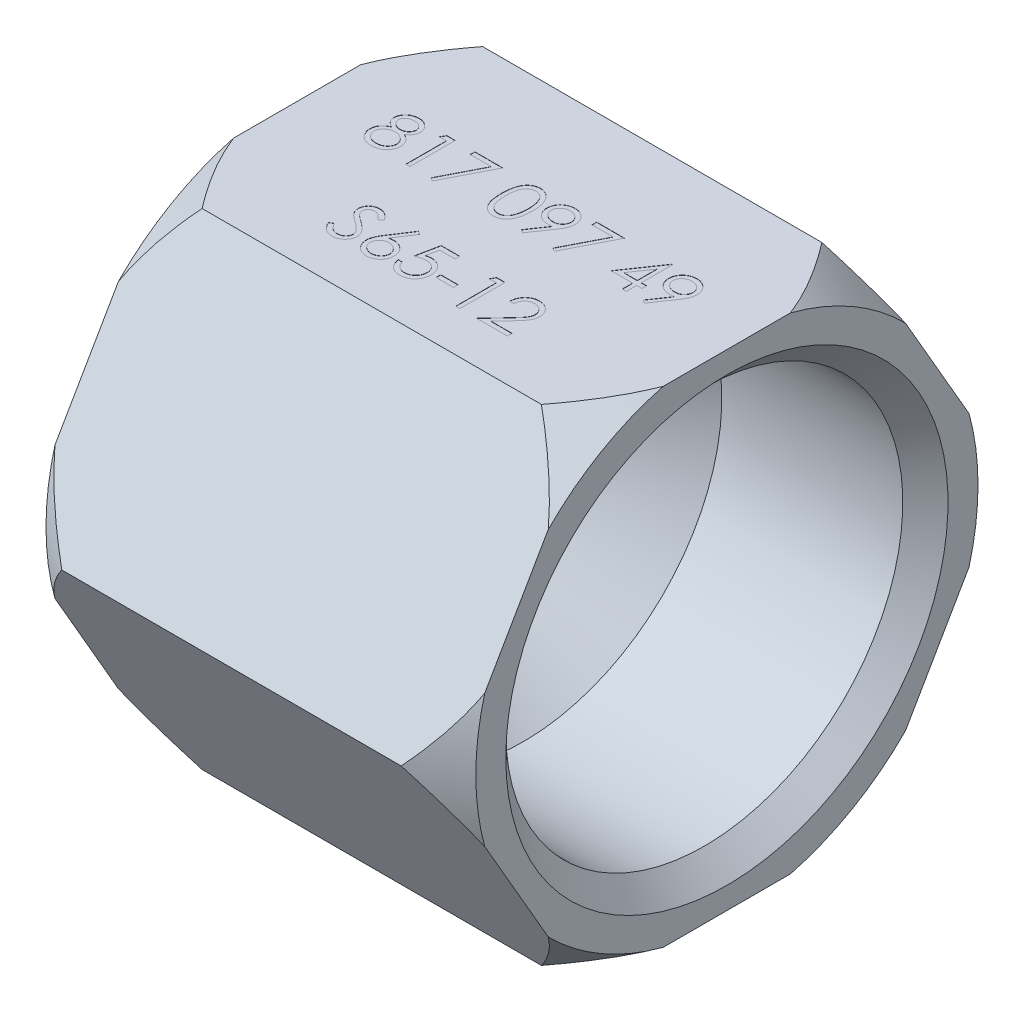
from build123d import *

# Parameters (mm, degrees)
SKETCH2_OUTSIDE_W  = 34.778
SKETCH2_OUTSIDE_H  = 34.778
EXTRUDE1_DEPTH     = 19
CHAMFER1_SIZE      = 1
SKETCH3_W          = 0.769230769
SKETCH3_H          = 0.205128205
CUT_EXTRUDE1_DEPTH = 0.01


with BuildPart() as part:
    # Sketch1 → Revolve1 (revolve)
    with BuildSketch(Plane.XY, mode=Mode.PRIVATE) as revolve1_sk:
        Polygon((0, 0), (0, 11.1), (2, 12.4), (17, 12.4), (19, 11.1), (19, 8.775), (10, 8.775), (5, 5), (1.995696905, 0), align=None)
    revolve(revolve1_sk.sketch.rotate(Axis((0, 0, 0), (1, 0, 0)), 90), axis=Axis((0, 0, 0), (1, 0, 0)))

    # Sketch2 outside → Extrude1 (cut)
    with BuildSketch(Plane(origin=(19, 0, 0), x_dir=(0, 0, -1), z_dir=(1, 0, 0))):
        Rectangle(SKETCH2_OUTSIDE_W, SKETCH2_OUTSIDE_H)
        Polygon((6.2, 10.738715007), (-6.2, 10.738715007), (-12.4, 0), (-6.2, -10.738715007), (6.2, -10.738715007), (12.4, 0), align=None, mode=Mode.SUBTRACT)
    extrude(amount=-EXTRUDE1_DEPTH, mode=Mode.SUBTRACT)

    # Chamfer1
    chamfer1_edges = [part.edges().sort_by_distance(p)[0] for p in [
        (19, 0, -8.775),
    ]]
    chamfer(chamfer1_edges, length=CHAMFER1_SIZE)

    # Sketch3 → Cut-Extrude1 (cut)
    # profile 1 of 14: a face of its own
    with BuildSketch(Plane(origin=(0, 10.738715007, 0), x_dir=(1, 0, 0), z_dir=(0, 1, 0))):
        with BuildLine():
            add(Edge.make_bspline(
                [(3.626201923, 1.114182692), (3.642572521, 1.105646717), (3.674500656, 1.088998716), (3.719973346, 1.062192529), (3.761530489, 1.033940549), (3.800325096, 1.0055772), (3.835675582, 0.976016257), (3.867186675, 0.945140167), (3.895636744, 0.913719627), (3.920452049, 0.881222576), (3.942278813, 0.847735348), (3.96114289, 0.813170049), (3.977267006, 0.77760243), (3.990045828, 0.740644241), (4.000572566, 0.702838377), (4.007815769, 0.663696673), (4.011711151, 0.62347705), (4.012447616, 0.596295163), (4.012820513, 0.582532051)],
                knots=[0, 0, 0, 0, 1.272397273, 2.481599622, 3.635517121, 4.734568067, 5.792894095, 6.808321871, 7.773003508, 8.711915296, 9.623354172, 10.525449501, 11.423591555, 12.311487226, 13.218079475, 14.126165749, 15.051214107, 16, 16, 16, 16], degree=3))
            add(Edge.make_bspline(
                [(4.012820513, 0.582532051), (4.012379701, 0.563276204), (4.011507169, 0.525161657), (4.003907178, 0.468906736), (3.992528334, 0.414271433), (3.975911469, 0.361267723), (3.95436096, 0.310188082), (3.927802768, 0.260988782), (3.897739223, 0.212863463), (3.873595086, 0.183252376), (3.861378205, 0.168269231)],
                knots=[0, 0, 0, 0, 1.025265484, 2.029385089, 3.018602448, 3.995076438, 4.983346944, 5.966715145, 6.97116228, 8, 8, 8, 8], degree=3))
            add(Edge.make_bspline(
                [(3.861378205, 0.168269231), (3.845471648, 0.150787074), (3.813855097, 0.116038793), (3.759693424, 0.070924044), (3.700252347, 0.033010105), (3.635761871, 0.002111879), (3.566394385, -0.021937183), (3.492164668, -0.039218622), (3.412928009, -0.049117153), (3.35846774, -0.050548004), (3.330528846, -0.051282051)],
                knots=[0, 0, 0, 0, 0.954267603, 1.896743057, 2.838368354, 3.796610408, 4.779680527, 5.799409237, 6.871065594, 8, 8, 8, 8], degree=3))
            add(Edge.make_bspline(
                [(3.330528846, -0.051282051), (3.303664053, -0.050623492), (3.251387893, -0.049342004), (3.175297678, -0.040659472), (3.104370209, -0.025443548), (3.038193084, -0.004618057), (2.97716526, 0.022473502), (2.92146063, 0.056192593), (2.870275503, 0.095181989), (2.825163233, 0.140561462), (2.785112693, 0.18916596), (2.749930949, 0.239309737), (2.720688618, 0.29099737), (2.695930278, 0.343458151), (2.676977122, 0.397427382), (2.663850145, 0.45262739), (2.655513394, 0.508961757), (2.654404174, 0.546979845), (2.653846154, 0.566105769)],
                knots=[0, 0, 0, 0, 1.256902934, 2.445805442, 3.576955095, 4.645999104, 5.686449165, 6.692658513, 7.68621702, 8.689161843, 9.678783111, 10.630372946, 11.551080876, 12.453998257, 13.34127905, 14.221779781, 15.105423033, 16, 16, 16, 16], degree=3))
            add(Edge.make_bspline(
                [(2.653846154, 0.566105769), (2.654176372, 0.580139593), (2.654828998, 0.607875383), (2.659346054, 0.648852142), (2.666608032, 0.688735648), (2.676470579, 0.727673215), (2.68983688, 0.765381371), (2.705975242, 0.802038785), (2.7247935, 0.837686841), (2.746554166, 0.872520487), (2.771869608, 0.906051637), (2.800534551, 0.938849348), (2.833121905, 0.970404701), (2.869269138, 1.00110323), (2.908563161, 1.0314895), (2.952024607, 1.059921345), (2.998501331, 1.088411611), (3.031532992, 1.10544494), (3.048477564, 1.114182692)],
                knots=[0, 0, 0, 0, 0.941657376, 1.861047343, 2.762797495, 3.66048619, 4.553285746, 5.444104102, 6.34607688, 7.256116206, 8.197091036, 9.162375105, 10.176350973, 11.237807142, 12.343728897, 13.50695164, 14.721116704, 16, 16, 16, 16], degree=3))
            add(Edge.make_bspline(
                [(3.048477564, 1.114182692), (3.025282493, 1.126831132), (2.980370343, 1.15132205), (2.920902091, 1.196320225), (2.869821734, 1.245056119), (2.828533324, 1.298558859), (2.796034908, 1.355157073), (2.773738563, 1.414496646), (2.758654858, 1.475477282), (2.757160671, 1.517137966), (2.756410256, 1.538060897)],
                knots=[0, 0, 0, 0, 1.166880483, 2.259407225, 3.286803203, 4.280235371, 5.237608625, 6.161067461, 7.076446754, 8, 8, 8, 8], degree=3))
            add(Edge.make_bspline(
                [(2.756410256, 1.538060897), (2.757344784, 1.559373788), (2.759223349, 1.602216415), (2.774413818, 1.665991342), (2.799168141, 1.72862938), (2.832837283, 1.78982693), (2.874772835, 1.847512767), (2.925085147, 1.89925045), (2.982572745, 1.944571297), (3.046948669, 1.982614825), (3.116226518, 2.013576915), (3.189321217, 2.034936014), (3.264959213, 2.048899509), (3.316443624, 2.050480455), (3.342548077, 2.051282051)],
                knots=[0, 0, 0, 0, 0.888701115, 1.786444228, 2.72001202, 3.692817113, 4.693886446, 5.687152267, 6.695133018, 7.739871481, 8.800368666, 9.853104506, 10.91144658, 12, 12, 12, 12], degree=3))
            add(Edge.make_bspline(
                [(3.342548077, 2.051282051), (3.367978828, 2.05045557), (3.418125373, 2.048825842), (3.491836589, 2.03523334), (3.56236509, 2.012530757), (3.629467661, 1.981732344), (3.691943014, 1.943796949), (3.747144333, 1.897853592), (3.795905809, 1.846344135), (3.836239748, 1.78867579), (3.869475685, 1.727713394), (3.892619057, 1.663929096), (3.907448757, 1.598701062), (3.90931925, 1.55456506), (3.91025641, 1.532451923)],
                knots=[0, 0, 0, 0, 1.072916533, 2.115669174, 3.151510826, 4.193348718, 5.225979165, 6.227137561, 7.216255879, 8.211077061, 9.189680878, 10.138522389, 11.067357538, 12, 12, 12, 12], degree=3))
            add(Edge.make_bspline(
                [(3.91025641, 1.532451923), (3.909436661, 1.510750972), (3.907826721, 1.468131538), (3.894283898, 1.406002098), (3.871476291, 1.347818076), (3.840336769, 1.292919246), (3.799750776, 1.242301247), (3.750260072, 1.195320407), (3.692259227, 1.151590791), (3.648681578, 1.126912869), (3.626201923, 1.114182692)],
                knots=[0, 0, 0, 0, 0.975232327, 1.915300861, 2.843280834, 3.77672583, 4.742871857, 5.749627742, 6.839139064, 8, 8, 8, 8], degree=3))
        make_face()
        with BuildLine():
            add(Edge.make_bspline(
                [(3.332532051, 1.846153846), (3.318503019, 1.845781594), (3.291056099, 1.845053307), (3.250811144, 1.841248372), (3.21254122, 1.833846534), (3.175846476, 1.823995841), (3.141230012, 1.81068842), (3.108221695, 1.795034129), (3.077383301, 1.776002091), (3.048342557, 1.754652835), (3.022199257, 1.731171175), (2.998996656, 1.706706192), (2.979723448, 1.680777397), (2.9633571, 1.654029763), (2.951481947, 1.625669433), (2.942588059, 1.596565904), (2.936575835, 1.566351399), (2.936125326, 1.545701964), (2.935897436, 1.53525641)],
                knots=[0, 0, 0, 0, 1.203892937, 2.355340988, 3.463153438, 4.544400666, 5.610487187, 6.640501085, 7.674077295, 8.714426146, 9.728707835, 10.68524104, 11.601827946, 12.495867327, 13.368432065, 14.231010473, 15.105153427, 16, 16, 16, 16], degree=3))
            add(Edge.make_bspline(
                [(2.935897436, 1.53525641), (2.936290217, 1.524810405), (2.937066409, 1.504167597), (2.943069339, 1.473684245), (2.952016113, 1.443729024), (2.966102206, 1.415014218), (2.982997267, 1.386543727), (3.00384954, 1.359029107), (3.028700413, 1.332374601), (3.056716093, 1.30680692), (3.087236972, 1.28286477), (3.11957071, 1.262080095), (3.153311506, 1.244689174), (3.188112688, 1.230215229), (3.224328944, 1.218963836), (3.261738357, 1.210981752), (3.300347216, 1.206020611), (3.326507547, 1.205428028), (3.33974359, 1.205128205)],
                knots=[0, 0, 0, 0, 0.873023192, 1.725219244, 2.590779336, 3.480155217, 4.391973325, 5.357036234, 6.360879153, 7.436073238, 8.526419356, 9.601555421, 10.645666583, 11.697338044, 12.750135903, 13.812665442, 14.89329948, 16, 16, 16, 16], degree=3))
            add(Edge.make_bspline(
                [(3.33974359, 1.205128205), (3.356743649, 1.205626986), (3.390575859, 1.206619622), (3.440449763, 1.215848865), (3.488942703, 1.230366532), (3.535536362, 1.25022937), (3.579024697, 1.275159575), (3.61779045, 1.305007014), (3.65150296, 1.339082498), (3.67981188, 1.376855547), (3.701760364, 1.417056455), (3.718847111, 1.457399479), (3.728824949, 1.49831504), (3.730126415, 1.525724734), (3.730769231, 1.539262821)],
                knots=[0, 0, 0, 0, 1.076279235, 2.141928126, 3.20205304, 4.278698113, 5.344010996, 6.36967002, 7.368914609, 8.37248503, 9.349703398, 10.264243087, 11.142681841, 12, 12, 12, 12], degree=3))
            add(Edge.make_bspline(
                [(3.730769231, 1.539262821), (3.730465289, 1.548764555), (3.729862009, 1.567624137), (3.724890548, 1.595474631), (3.716675787, 1.622691536), (3.705554027, 1.649499691), (3.690919858, 1.675522967), (3.673568894, 1.701170445), (3.652492036, 1.725865168), (3.628836931, 1.750182624), (3.602010983, 1.77268778), (3.572065891, 1.792479043), (3.539155176, 1.809286104), (3.503278062, 1.822936821), (3.464566677, 1.833189592), (3.42319932, 1.840867505), (3.378831065, 1.845194998), (3.348299778, 1.845827298), (3.332532051, 1.846153846)],
                knots=[0, 0, 0, 0, 0.814439003, 1.616544685, 2.417341072, 3.248991801, 4.09997495, 4.973547432, 5.9003056, 6.880240646, 7.880314356, 8.896779544, 9.951930927, 11.043077905, 12.18215768, 13.381699519, 14.647792085, 16, 16, 16, 16], degree=3))
        make_face(mode=Mode.SUBTRACT)
        with BuildLine():
            add(Edge.make_bspline(
                [(3.344150641, 1), (3.326364478, 0.999683634), (3.291472366, 0.999063), (3.240354121, 0.992154714), (3.191295169, 0.982537918), (3.14446092, 0.967948867), (3.09987115, 0.948979444), (3.057284474, 0.926159707), (3.017026686, 0.899185168), (2.9796537, 0.868398531), (2.945526083, 0.8352217), (2.915584197, 0.80010048), (2.890157043, 0.763687604), (2.869680899, 0.725520616), (2.852874195, 0.686407695), (2.841837694, 0.645374784), (2.83476243, 0.603210719), (2.833812355, 0.574547805), (2.833333333, 0.560096154)],
                knots=[0, 0, 0, 0, 1.140299081, 2.23698856, 3.303958914, 4.344563908, 5.37730929, 6.408454204, 7.439741482, 8.480804886, 9.510774543, 10.48932336, 11.43758569, 12.353841022, 13.263987381, 14.161954604, 15.073269652, 16, 16, 16, 16], degree=3))
            add(Edge.make_bspline(
                [(2.833333333, 0.560096154), (2.834112338, 0.542135636), (2.835657866, 0.506502388), (2.847918803, 0.453837776), (2.867596251, 0.402854316), (2.895039232, 0.353967486), (2.929020702, 0.308281711), (2.970807255, 0.268459554), (3.01780202, 0.233075852), (3.071595079, 0.204458404), (3.130354202, 0.181604201), (3.194063762, 0.165857937), (3.26180943, 0.155434251), (3.30858634, 0.154383862), (3.332532051, 0.153846154)],
                knots=[0, 0, 0, 0, 0.898778495, 1.783155532, 2.693654817, 3.627872908, 4.583023416, 5.533784346, 6.509005473, 7.520592997, 8.575161974, 9.658835044, 10.801527049, 12, 12, 12, 12], degree=3))
            add(Edge.make_bspline(
                [(3.332532051, 0.153846154), (3.351246547, 0.154205473), (3.387708387, 0.154905542), (3.440900357, 0.161085139), (3.491097242, 0.170884924), (3.538201699, 0.185138379), (3.582741036, 0.202538365), (3.623960095, 0.224922412), (3.662919253, 0.250380882), (3.697698752, 0.280585543), (3.729374871, 0.31285954), (3.756993896, 0.347025279), (3.780969639, 0.382154212), (3.799787328, 0.419040203), (3.814830902, 0.456975583), (3.825644362, 0.496310161), (3.832316485, 0.53716458), (3.832991282, 0.564878334), (3.833333333, 0.578926282)],
                knots=[0, 0, 0, 0, 1.224942928, 2.386581632, 3.501229538, 4.569074225, 5.605009692, 6.626002462, 7.634866581, 8.645888296, 9.63523824, 10.59253846, 11.518950513, 12.414518923, 13.29783783, 14.186679152, 15.080837789, 16, 16, 16, 16], degree=3))
            add(Edge.make_bspline(
                [(3.833333333, 0.578926282), (3.832815706, 0.592570477), (3.831795034, 0.619474445), (3.825316925, 0.659341032), (3.813936424, 0.697856926), (3.798320768, 0.7354855), (3.777531647, 0.771464329), (3.753048864, 0.806730713), (3.723509367, 0.840305824), (3.690130741, 0.87245045), (3.653754192, 0.902173729), (3.615087252, 0.928467694), (3.57442756, 0.95061176), (3.531861153, 0.968621186), (3.48748255, 0.982785454), (3.441324391, 0.992680309), (3.393332634, 0.998908653), (3.36072985, 0.999632108), (3.344150641, 1)],
                knots=[0, 0, 0, 0, 0.917430815, 1.809013306, 2.70690318, 3.612392954, 4.541220862, 5.495268465, 6.494511384, 7.542276156, 8.608045339, 9.649016899, 10.681629292, 11.715607085, 12.752076957, 13.808767841, 14.885711793, 16, 16, 16, 16], degree=3))
        make_face(mode=Mode.SUBTRACT)
    # profile 2 of 14: a face of its own
    with BuildSketch(Plane(origin=(0, 10.738715007, 0), x_dir=(1, 0, 0), z_dir=(0, 1, 0))):
        Polygon((4.617387821, 2), (4.987179487, 2), (4.987179487, 0), (4.807692308, 0), (4.807692308, 1.794871795), (4.5, 1.794871795), align=None)
    # profile 3 of 14: a face of its own
    with BuildSketch(Plane(origin=(0, 10.738715007, 0), x_dir=(1, 0, 0), z_dir=(0, 1, 0))):
        Polygon((5.858974359, 2), (7.08974359, 2), (6.038461538, -0.051282051), (5.883413462, 0.034054487), (6.786057692, 1.794871795), (5.858974359, 1.794871795), align=None)
    # profile 4 of 14: a face of its own
    with BuildSketch(Plane(origin=(0, 10.738715007, 0), x_dir=(1, 0, 0), z_dir=(0, 1, 0))):
        with BuildLine():
            add(Edge.make_bspline(
                [(8.038461538, 0.999198718), (8.038648977, 1.031254368), (8.03901308, 1.093522931), (8.043063607, 1.184257012), (8.049792374, 1.269377177), (8.059013729, 1.3488875), (8.070235432, 1.422808509), (8.085215711, 1.490942656), (8.102251598, 1.553605288), (8.121995852, 1.611000744), (8.144274589, 1.663902289), (8.168522738, 1.713288118), (8.195702621, 1.759083508), (8.224260857, 1.802019388), (8.255353469, 1.841392928), (8.288095635, 1.877760164), (8.323765278, 1.910280593), (8.361149855, 1.939907051), (8.400587834, 1.965878178), (8.440955072, 1.988754028), (8.482529418, 2.00829681), (8.52542438, 2.023662773), (8.569254413, 2.036354686), (8.614172737, 2.045034084), (8.660253516, 2.050495175), (8.691357193, 2.051017271), (8.70713141, 2.051282051)],
                knots=[0, 0, 0, 0, 1.646270934, 3.197905019, 4.663502075, 6.030701355, 7.308322542, 8.50163776, 9.611534131, 10.641858119, 11.616356847, 12.558055219, 13.465016945, 14.349605745, 15.204443733, 16.039544428, 16.859896111, 17.680448484, 18.487036065, 19.28249412, 20.06191084, 20.843045899, 21.620316918, 22.403196591, 23.190181807, 24, 24, 24, 24], degree=3))
            add(Edge.make_bspline(
                [(8.70713141, 2.051282051), (8.723037398, 2.0510033), (8.754669403, 2.050448951), (8.801435332, 2.045120984), (8.847120864, 2.036280342), (8.891531229, 2.023754071), (8.935031221, 2.008213684), (8.977280597, 1.988735331), (9.018541787, 1.966061693), (9.058159094, 1.939419477), (9.096567445, 1.909715319), (9.132823424, 1.876136651), (9.166930331, 1.839022526), (9.199316219, 1.798770032), (9.229062275, 1.754607127), (9.25738995, 1.707301921), (9.2827454, 1.656027141), (9.307165214, 1.601638303), (9.328243492, 1.542630498), (9.347252775, 1.479336349), (9.362612186, 1.411008242), (9.375406056, 1.338004673), (9.385317425, 1.26005754), (9.392536077, 1.177333931), (9.396349269, 1.089779422), (9.397067384, 1.029917794), (9.397435897, 0.999198718)],
                knots=[0, 0, 0, 0, 0.810914788, 1.612654377, 2.396697861, 3.181598691, 3.963628158, 4.749916497, 5.551656086, 6.361998678, 7.18212741, 8.025565596, 8.878627764, 9.750805457, 10.657531673, 11.591944965, 12.560506719, 13.57287815, 14.630710178, 15.753379473, 16.941251878, 18.199788006, 19.531962791, 20.947069417, 22.433333509, 24, 24, 24, 24], degree=3))
            add(Edge.make_bspline(
                [(9.397435897, 0.999198718), (9.397063563, 0.968613628), (9.396338086, 0.909019827), (9.392578825, 0.821859269), (9.385173893, 0.739574673), (9.375911042, 0.661968695), (9.36308192, 0.589364341), (9.34730754, 0.52151037), (9.32979307, 0.458113758), (9.308173187, 0.399693866), (9.284509924, 0.345435738), (9.258764098, 0.294768796), (9.23118134, 0.247245201), (9.201130629, 0.203245345), (9.169100107, 0.162457541), (9.134404227, 0.125601757), (9.098021036, 0.091789944), (9.059499655, 0.0617033), (9.019264483, 0.035369126), (8.978145011, 0.011818354), (8.935411649, -0.007171757), (8.892032819, -0.023477495), (8.847388038, -0.035934896), (8.801532958, -0.044548528), (8.754700823, -0.050589584), (8.723042786, -0.05105043), (8.70713141, -0.051282051)],
                knots=[0, 0, 0, 0, 1.561518951, 3.042555995, 4.452378317, 5.7783523, 7.031515105, 8.214008947, 9.334062868, 10.386615937, 11.391082383, 12.354592575, 13.286541444, 14.194233754, 15.072674879, 15.931287219, 16.775624067, 17.606195743, 18.42308326, 19.229000347, 20.022332153, 20.807536673, 21.593273796, 22.3848459, 23.188221202, 24, 24, 24, 24], degree=3))
            add(Edge.make_bspline(
                [(8.70713141, -0.051282051), (8.691357631, -0.051015562), (8.660254817, -0.050490098), (8.614167716, -0.04505368), (8.569434892, -0.036313393), (8.525835604, -0.024075333), (8.483146166, -0.009095427), (8.441948288, 0.010420964), (8.401783898, 0.032897574), (8.362760151, 0.058494958), (8.325610345, 0.087821634), (8.290125428, 0.120258371), (8.257196845, 0.156614606), (8.226548791, 0.196316276), (8.19742074, 0.238998129), (8.170626813, 0.285242913), (8.145843468, 0.334867262), (8.123190044, 0.388191783), (8.103105094, 0.445994599), (8.085363546, 0.508936986), (8.071355456, 0.577574493), (8.059365196, 0.651355845), (8.04969412, 0.730598091), (8.043091648, 0.81534425), (8.039010897, 0.905541512), (8.038648, 0.967409955), (8.038461538, 0.999198718)],
                knots=[0, 0, 0, 0, 0.810891512, 1.598919785, 2.382837074, 3.152667961, 3.926044502, 4.706494248, 5.493654104, 6.291793342, 7.103789334, 7.925228297, 8.761435821, 9.622817696, 10.50288917, 11.416980706, 12.369136599, 13.353924996, 14.394355917, 15.514179734, 16.714354668, 17.994756427, 19.357759367, 20.818452758, 22.365282078, 24, 24, 24, 24], degree=3))
        make_face()
        with BuildLine():
            add(Edge.make_bspline(
                [(8.217948718, 1), (8.218016973, 0.973286458), (8.218149444, 0.921440718), (8.22161013, 0.846101712), (8.226324548, 0.775832952), (8.232405289, 0.710545217), (8.241435546, 0.650459496), (8.25155371, 0.595162534), (8.263866904, 0.54494697), (8.278435486, 0.499468221), (8.295029256, 0.457954468), (8.313146892, 0.419325202), (8.332610162, 0.383124095), (8.354392534, 0.349676319), (8.378115427, 0.318872797), (8.403243004, 0.290168321), (8.430713052, 0.264570046), (8.468715191, 0.233868986), (8.518884605, 0.202143767), (8.582096293, 0.17451743), (8.647049694, 0.157156026), (8.691136122, 0.154948165), (8.713141026, 0.153846154)],
                knots=[0, 0, 0, 0, 1.459021318, 2.831673884, 4.118529203, 5.306027144, 6.411944654, 7.436330062, 8.375795394, 9.233974572, 10.042671642, 10.816086306, 11.563610507, 12.285937304, 12.993564865, 13.685989202, 14.367179055, 15.041617293, 16.353048772, 17.594441528, 18.799311195, 20, 20, 20, 20], degree=3))
            add(Edge.make_bspline(
                [(8.713141026, 0.153846154), (8.735288267, 0.154759171), (8.779537023, 0.156583322), (8.844184906, 0.1741826), (8.90694506, 0.200736623), (8.956129026, 0.232135197), (8.993547622, 0.2620371), (9.020357331, 0.287531184), (9.044964216, 0.316077394), (9.068302544, 0.346876992), (9.08970773, 0.380518412), (9.10917238, 0.416839883), (9.126934293, 0.455942271), (9.137053748, 0.483239264), (9.142227564, 0.497195513)],
                knots=[0, 0, 0, 0, 1.353760809, 2.704726607, 4.075137775, 5.516104923, 6.260822281, 7.007110065, 7.778089737, 8.566572457, 9.372053459, 10.217411131, 11.088608312, 12, 12, 12, 12], degree=3))
            add(Edge.make_bspline(
                [(9.142227564, 0.497195513), (9.148257146, 0.515041078), (9.160499782, 0.551275229), (9.176277939, 0.60748303), (9.188703881, 0.666456038), (9.199882947, 0.727841819), (9.207513265, 0.792093077), (9.213654873, 0.859011011), (9.217272408, 0.928646075), (9.217720837, 0.975957498), (9.217948718, 1)],
                knots=[0, 0, 0, 0, 0.884706709, 1.796334032, 2.740027952, 3.714592787, 4.726048262, 5.777819803, 6.87074269, 8, 8, 8, 8], degree=3))
            add(Edge.make_bspline(
                [(9.217948718, 1), (9.217634324, 1.024038613), (9.217019303, 1.071063278), (9.214668452, 1.13993081), (9.208597838, 1.205340959), (9.201855485, 1.267575515), (9.191914216, 1.326289974), (9.181195469, 1.381975863), (9.166794776, 1.433943305), (9.151412048, 1.483005923), (9.133806107, 1.528606297), (9.114425688, 1.570957033), (9.09372754, 1.61026259), (9.071246259, 1.646415128), (9.047248726, 1.679576581), (9.021101555, 1.709082063), (8.993841914, 1.735846045), (8.955660665, 1.766396085), (8.905675356, 1.797545625), (8.843477843, 1.826211773), (8.778751761, 1.842673655), (8.734995502, 1.844994619), (8.713141026, 1.846153846)],
                knots=[0, 0, 0, 0, 1.31362396, 2.569729283, 3.763502607, 4.902122613, 5.988968491, 7.01645872, 7.998833611, 8.933434873, 9.825090667, 10.667526885, 11.477055099, 12.250526234, 12.991942729, 13.710640831, 14.402115721, 15.076753259, 16.378508321, 17.609869233, 18.806226677, 20, 20, 20, 20], degree=3))
            add(Edge.make_bspline(
                [(8.713141026, 1.846153846), (8.691020687, 1.844993019), (8.646739713, 1.842669251), (8.581340881, 1.826273107), (8.51865268, 1.797694269), (8.468799552, 1.766292913), (8.430591674, 1.736385307), (8.403687278, 1.71045019), (8.378460894, 1.682080902), (8.355222208, 1.650994093), (8.333456903, 1.617585312), (8.313467753, 1.581591732), (8.295457851, 1.542830953), (8.278838116, 1.501335847), (8.264225094, 1.455861021), (8.252171401, 1.405707311), (8.241035942, 1.35058623), (8.233152931, 1.290175082), (8.22614507, 1.224870995), (8.221641443, 1.154426813), (8.218137867, 1.078961452), (8.218013031, 1.026847648), (8.217948718, 1)],
                knots=[0, 0, 0, 0, 1.207732386, 2.417664972, 3.655092373, 4.956220595, 5.625982001, 6.301752483, 6.994047911, 7.697131622, 8.419323945, 9.170223765, 9.943494443, 10.752040957, 11.610060368, 12.549350801, 13.567764191, 14.679664412, 15.874934091, 17.154273443, 18.533957287, 20, 20, 20, 20], degree=3))
        make_face(mode=Mode.SUBTRACT)
    # profile 5 of 14: a face of its own
    with BuildSketch(Plane(origin=(0, 10.738715007, 0), x_dir=(1, 0, 0), z_dir=(0, 1, 0))):
        with BuildLine():
            Line((10.012820513, -0.051282051), (9.869391026, 0.048477564))
            Line((9.869391026, 0.048477564), (10.425480769, 0.861378205))
            add(Edge.make_bspline(
                [(10.425480769, 0.861378205), (10.390000349, 0.857039312), (10.320137423, 0.848495789), (10.249773365, 0.846926272), (10.215144231, 0.846153846)],
                knots=[0, 0, 0, 0, 1.015715272, 2, 2, 2, 2], degree=3))
            add(Edge.make_bspline(
                [(10.215144231, 0.846153846), (10.194148775, 0.846691604), (10.152936531, 0.847747176), (10.092347015, 0.856113924), (10.034126695, 0.868999711), (9.97842992, 0.888227571), (9.925047346, 0.91212369), (9.87409551, 0.94175627), (9.825643001, 0.976617008), (9.780210195, 1.016521574), (9.738889201, 1.060337604), (9.702075888, 1.106712257), (9.671480956, 1.156184241), (9.646065764, 1.207744366), (9.626791219, 1.262133709), (9.612755484, 1.318733367), (9.604114138, 1.377940019), (9.603086084, 1.418240094), (9.602564103, 1.438701923)],
                knots=[0, 0, 0, 0, 1.060718605, 2.082097864, 3.085795603, 4.069760067, 5.054557537, 6.03741023, 7.043284206, 8.066802108, 9.088538119, 10.083643548, 11.053783639, 12.022749082, 12.983451788, 13.964007469, 14.966251758, 16, 16, 16, 16], degree=3))
            add(Edge.make_bspline(
                [(9.602564103, 1.438701923), (9.603555208, 1.46668401), (9.605500547, 1.521607171), (9.621156843, 1.601855039), (9.646905608, 1.677733064), (9.682807538, 1.749041746), (9.728027379, 1.814755312), (9.782375144, 1.873960231), (9.845520267, 1.925814433), (9.916024278, 1.970388192), (9.992226004, 2.006236762), (10.072036666, 2.032659219), (10.154844734, 2.048201361), (10.210940546, 2.050250424), (10.239182692, 2.051282051)],
                knots=[0, 0, 0, 0, 1.022988612, 2.007919123, 2.978103895, 3.94594894, 4.918897164, 5.887013414, 6.875921846, 7.89917871, 8.930658928, 9.948724884, 10.967259574, 12, 12, 12, 12], degree=3))
            add(Edge.make_bspline(
                [(10.239182692, 2.051282051), (10.266890361, 2.050236244), (10.321638102, 2.048169827), (10.402146105, 2.03303613), (10.479255258, 2.00752946), (10.552538108, 1.972281138), (10.6203892, 1.928097762), (10.681403949, 1.875449463), (10.734189972, 1.814303447), (10.778660761, 1.746138596), (10.814357927, 1.672900321), (10.840113517, 1.596452365), (10.855968168, 1.517344524), (10.857966069, 1.463747682), (10.858974359, 1.436698718)],
                knots=[0, 0, 0, 0, 1.026385292, 2.028040595, 3.023318987, 4.028184125, 5.03290303, 6.015178782, 7.004435299, 8.016004309, 9.023023918, 10.015172535, 10.998308025, 12, 12, 12, 12], degree=3))
            add(Edge.make_bspline(
                [(10.858974359, 1.436698718), (10.858300982, 1.41570228), (10.856935207, 1.373116256), (10.847371603, 1.308413203), (10.831131497, 1.242441072), (10.812701955, 1.18660016), (10.794912144, 1.140481046), (10.778168641, 1.104051572), (10.759590267, 1.065707993), (10.737922401, 1.025852371), (10.71462966, 0.983976637), (10.688310074, 0.940500799), (10.659564033, 0.895366518), (10.639089907, 0.86493961), (10.628605769, 0.849358974)],
                knots=[0, 0, 0, 0, 1.179839688, 2.393009684, 3.667231171, 4.993948276, 5.694988576, 6.444077775, 7.246288328, 8.089075292, 8.993003841, 9.939041771, 10.944649915, 12, 12, 12, 12], degree=3))
            Line((10.628605769, 0.849358974), (10.012820513, -0.051282051))
        make_face()
        with BuildLine():
            add(Edge.make_bspline(
                [(10.248397436, 1.051282051), (10.264302587, 1.051716556), (10.295264509, 1.05256239), (10.340622965, 1.057710528), (10.383436796, 1.06683852), (10.423820367, 1.079935498), (10.462178596, 1.095739309), (10.497902212, 1.115860444), (10.531021113, 1.13986995), (10.561757071, 1.166847102), (10.589050785, 1.196818864), (10.613361088, 1.228188639), (10.63402427, 1.26109413), (10.650346142, 1.295947423), (10.6637659, 1.331900114), (10.673033335, 1.369531174), (10.67816724, 1.408644546), (10.679042426, 1.435215207), (10.679487179, 1.448717949)],
                knots=[0, 0, 0, 0, 1.163407946, 2.26475976, 3.333800367, 4.359385343, 5.366239384, 6.363380779, 7.350133999, 8.353570782, 9.349036268, 10.310270964, 11.253520213, 12.184142, 13.120487599, 14.056272588, 15.012232024, 16, 16, 16, 16], degree=3))
            add(Edge.make_bspline(
                [(10.679487179, 1.448717949), (10.679104511, 1.462226329), (10.678350417, 1.488846249), (10.672300531, 1.528017529), (10.661657547, 1.565556535), (10.64737727, 1.601668781), (10.628565705, 1.636057565), (10.605992285, 1.669154634), (10.579173742, 1.700750136), (10.548315133, 1.730100984), (10.515038245, 1.757156926), (10.479575103, 1.781034684), (10.442218008, 1.801046796), (10.403194871, 1.817560493), (10.362424385, 1.830447222), (10.319930678, 1.839714287), (10.275499018, 1.844841004), (10.245338283, 1.845710658), (10.229967949, 1.846153846)],
                knots=[0, 0, 0, 0, 0.972161553, 1.915763587, 2.844109794, 3.775983486, 4.705125789, 5.659731448, 6.655561913, 7.682237399, 8.721216875, 9.739758359, 10.754845918, 11.767244016, 12.7857855, 13.828538656, 14.893392813, 16, 16, 16, 16], degree=3))
            add(Edge.make_bspline(
                [(10.229967949, 1.846153846), (10.21473129, 1.845709942), (10.18483709, 1.844839007), (10.140800428, 1.839724032), (10.098594046, 1.830384898), (10.057941691, 1.817566462), (10.018919714, 1.801045564), (9.981564381, 1.781033635), (9.946092943, 1.757162422), (9.91284796, 1.730079695), (9.881934861, 1.700886755), (9.855577416, 1.669016224), (9.832952335, 1.636074781), (9.814166619, 1.601664205), (9.799879466, 1.565557756), (9.789238322, 1.528017198), (9.783187942, 1.488846335), (9.782433916, 1.462226358), (9.782051282, 1.448717949)],
                knots=[0, 0, 0, 0, 1.099389452, 2.15699305, 3.192601482, 4.213358962, 5.227959689, 6.245255729, 7.266013209, 8.307253147, 9.336162325, 10.327954924, 11.284637477, 12.215801273, 13.149702402, 14.080068371, 15.025723358, 16, 16, 16, 16], degree=3))
            add(Edge.make_bspline(
                [(9.782051282, 1.448717949), (9.782397526, 1.435204692), (9.783080381, 1.408554077), (9.789667689, 1.369396139), (9.800683849, 1.331860028), (9.815437787, 1.295580767), (9.834867267, 1.260911133), (9.858709466, 1.228015498), (9.886655492, 1.196520955), (9.918331771, 1.166916834), (9.952999291, 1.139744162), (9.990026003, 1.116012515), (10.028774482, 1.095971119), (10.069381128, 1.079890328), (10.111545013, 1.066969377), (10.155645088, 1.057727351), (10.20153551, 1.05261177), (10.232626928, 1.051729543), (10.248397436, 1.051282051)],
                knots=[0, 0, 0, 0, 0.952633368, 1.87876736, 2.791047057, 3.707742249, 4.635551637, 5.587206343, 6.568248508, 7.601284464, 8.641511608, 9.671105535, 10.699146789, 11.713763218, 12.747829548, 13.806491675, 14.887386225, 16, 16, 16, 16], degree=3))
        make_face(mode=Mode.SUBTRACT)
    # profile 6 of 14: a face of its own
    with BuildSketch(Plane(origin=(0, 10.738715007, 0), x_dir=(1, 0, 0), z_dir=(0, 1, 0))):
        Polygon((11.243589744, 2), (12.474358974, 2), (11.423076923, -0.051282051), (11.268028846, 0.034054487), (12.170673077, 1.794871795), (11.243589744, 1.794871795), align=None)
    # profile 7 of 14: a face of its own
    with BuildSketch(Plane(origin=(0, 10.738715007, 0), x_dir=(1, 0, 0), z_dir=(0, 1, 0))):
        Polygon((14.514823718, 2.051282051), (14.551282051, 2.051282051), (14.551282051, 0.666666667), (14.782051282, 0.666666667), (14.782051282, 0.461538462), (14.551282051, 0.461538462), (14.551282051, 0), (14.371794872, 0), (14.371794872, 0.461538462), (13.423076923, 0.461538462), align=None)
        Polygon((14.371794872, 0.666666667), (14.371794872, 1.53525641), (13.775641026, 0.666666667), align=None, mode=Mode.SUBTRACT)
    # profile 8 of 14: a face of its own
    with BuildSketch(Plane(origin=(0, 10.738715007, 0), x_dir=(1, 0, 0), z_dir=(0, 1, 0))):
        with BuildLine():
            Line((15.397435897, -0.051282051), (15.25400641, 0.048477564))
            Line((15.25400641, 0.048477564), (15.810096154, 0.861378205))
            add(Edge.make_bspline(
                [(15.810096154, 0.861378205), (15.774615734, 0.857039312), (15.704752808, 0.848495789), (15.634388749, 0.846926272), (15.599759615, 0.846153846)],
                knots=[0, 0, 0, 0, 1.015715272, 2, 2, 2, 2], degree=3))
            add(Edge.make_bspline(
                [(15.599759615, 0.846153846), (15.578764159, 0.846691604), (15.537551916, 0.847747176), (15.4769624, 0.856113924), (15.41874208, 0.868999711), (15.363045305, 0.888227571), (15.309662731, 0.91212369), (15.258710894, 0.94175627), (15.210258385, 0.976617008), (15.16482558, 1.016521574), (15.123504586, 1.060337604), (15.086691273, 1.106712257), (15.056096341, 1.156184241), (15.030681149, 1.207744366), (15.011406604, 1.262133709), (14.997370868, 1.318733367), (14.988729523, 1.377940019), (14.987701468, 1.418240094), (14.987179487, 1.438701923)],
                knots=[0, 0, 0, 0, 1.060718605, 2.082097864, 3.085795603, 4.069760067, 5.054557537, 6.03741023, 7.043284206, 8.066802108, 9.088538119, 10.083643548, 11.053783639, 12.022749082, 12.983451788, 13.964007469, 14.966251758, 16, 16, 16, 16], degree=3))
            add(Edge.make_bspline(
                [(14.987179487, 1.438701923), (14.988170593, 1.46668401), (14.990115932, 1.521607171), (15.005772228, 1.601855039), (15.031520993, 1.677733064), (15.067422922, 1.749041746), (15.112642763, 1.814755312), (15.166990529, 1.873960231), (15.230135651, 1.925814433), (15.300639662, 1.970388192), (15.376841389, 2.006236762), (15.45665205, 2.032659219), (15.539460119, 2.048201361), (15.59555593, 2.050250424), (15.623798077, 2.051282051)],
                knots=[0, 0, 0, 0, 1.022988612, 2.007919123, 2.978103895, 3.94594894, 4.918897164, 5.887013414, 6.875921846, 7.89917871, 8.930658928, 9.948724884, 10.967259574, 12, 12, 12, 12], degree=3))
            add(Edge.make_bspline(
                [(15.623798077, 2.051282051), (15.651505745, 2.050236244), (15.706253486, 2.048169827), (15.78676149, 2.03303613), (15.863870643, 2.00752946), (15.937153492, 1.972281138), (16.005004585, 1.928097762), (16.066019334, 1.875449463), (16.118805356, 1.814303447), (16.163276145, 1.746138596), (16.198973311, 1.672900321), (16.224728902, 1.596452365), (16.240583552, 1.517344524), (16.242581454, 1.463747682), (16.243589744, 1.436698718)],
                knots=[0, 0, 0, 0, 1.026385292, 2.028040595, 3.023318987, 4.028184125, 5.03290303, 6.015178782, 7.004435299, 8.016004309, 9.023023918, 10.015172535, 10.998308025, 12, 12, 12, 12], degree=3))
            add(Edge.make_bspline(
                [(16.243589744, 1.436698718), (16.242916367, 1.41570228), (16.241550591, 1.373116256), (16.231986987, 1.308413203), (16.215746881, 1.242441072), (16.197317339, 1.18660016), (16.179527529, 1.140481046), (16.162784025, 1.104051572), (16.144205652, 1.065707993), (16.122537786, 1.025852371), (16.099245045, 0.983976637), (16.072925458, 0.940500799), (16.044179417, 0.895366518), (16.023705292, 0.86493961), (16.013221154, 0.849358974)],
                knots=[0, 0, 0, 0, 1.179839688, 2.393009684, 3.667231171, 4.993948276, 5.694988576, 6.444077775, 7.246288328, 8.089075292, 8.993003841, 9.939041771, 10.944649915, 12, 12, 12, 12], degree=3))
            Line((16.013221154, 0.849358974), (15.397435897, -0.051282051))
        make_face()
        with BuildLine():
            add(Edge.make_bspline(
                [(15.633012821, 1.051282051), (15.648917971, 1.051716556), (15.679879893, 1.05256239), (15.72523835, 1.057710528), (15.76805218, 1.06683852), (15.808435751, 1.079935498), (15.846793981, 1.095739309), (15.882517597, 1.115860444), (15.915636497, 1.13986995), (15.946372456, 1.166847102), (15.97366617, 1.196818864), (15.997976473, 1.228188639), (16.018639654, 1.26109413), (16.034961527, 1.295947423), (16.048381284, 1.331900114), (16.05764872, 1.369531174), (16.062782625, 1.408644546), (16.06365781, 1.435215207), (16.064102564, 1.448717949)],
                knots=[0, 0, 0, 0, 1.163407946, 2.26475976, 3.333800367, 4.359385343, 5.366239384, 6.363380779, 7.350133999, 8.353570782, 9.349036268, 10.310270964, 11.253520213, 12.184142, 13.120487599, 14.056272588, 15.012232024, 16, 16, 16, 16], degree=3))
            add(Edge.make_bspline(
                [(16.064102564, 1.448717949), (16.063719896, 1.462226329), (16.062965802, 1.488846249), (16.056915916, 1.528017529), (16.046272931, 1.565556535), (16.031992654, 1.601668781), (16.01318109, 1.636057565), (15.99060767, 1.669154634), (15.963789127, 1.700750136), (15.932930518, 1.730100984), (15.89965363, 1.757156926), (15.864190487, 1.781034684), (15.826833392, 1.801046796), (15.787810255, 1.817560493), (15.74703977, 1.830447222), (15.704546063, 1.839714287), (15.660114402, 1.844841004), (15.629953667, 1.845710658), (15.614583333, 1.846153846)],
                knots=[0, 0, 0, 0, 0.972161553, 1.915763587, 2.844109794, 3.775983486, 4.705125789, 5.659731448, 6.655561913, 7.682237399, 8.721216875, 9.739758359, 10.754845918, 11.767244016, 12.7857855, 13.828538656, 14.893392813, 16, 16, 16, 16], degree=3))
            add(Edge.make_bspline(
                [(15.614583333, 1.846153846), (15.599346674, 1.845709942), (15.569452475, 1.844839007), (15.525415812, 1.839724032), (15.483209431, 1.830384898), (15.442557076, 1.817566462), (15.403535099, 1.801045564), (15.366179766, 1.781033635), (15.330708327, 1.757162422), (15.297463344, 1.730079695), (15.266550246, 1.700886755), (15.240192801, 1.669016224), (15.21756772, 1.636074781), (15.198782004, 1.601664205), (15.184494851, 1.565557756), (15.173853707, 1.528017198), (15.167803327, 1.488846335), (15.1670493, 1.462226358), (15.166666667, 1.448717949)],
                knots=[0, 0, 0, 0, 1.099389452, 2.15699305, 3.192601482, 4.213358962, 5.227959689, 6.245255729, 7.266013209, 8.307253147, 9.336162325, 10.327954924, 11.284637477, 12.215801273, 13.149702402, 14.080068371, 15.025723358, 16, 16, 16, 16], degree=3))
            add(Edge.make_bspline(
                [(15.166666667, 1.448717949), (15.16701291, 1.435204692), (15.167695766, 1.408554077), (15.174283074, 1.369396139), (15.185299234, 1.331860028), (15.200053171, 1.295580767), (15.219482652, 1.260911133), (15.24332485, 1.228015498), (15.271270877, 1.196520955), (15.302947155, 1.166916834), (15.337614676, 1.139744162), (15.374641388, 1.116012515), (15.413389866, 1.095971119), (15.453996512, 1.079890328), (15.496160398, 1.066969377), (15.540260473, 1.057727351), (15.586150895, 1.05261177), (15.617242313, 1.051729543), (15.633012821, 1.051282051)],
                knots=[0, 0, 0, 0, 0.952633368, 1.87876736, 2.791047057, 3.707742249, 4.635551637, 5.587206343, 6.568248508, 7.601284464, 8.641511608, 9.671105535, 10.699146789, 11.713763218, 12.747829548, 13.806491675, 14.887386225, 16, 16, 16, 16], degree=3))
        make_face(mode=Mode.SUBTRACT)
    # profile 9 of 14: a face of its own
    with BuildSketch(Plane(origin=(0, 10.738715007, 0), x_dir=(1, 0, 0), z_dir=(0, 1, 0))):
        with BuildLine():
            Line((5.320512821, -3.947516026), (5.489583333, -3.846153846))
            add(Edge.make_bspline(
                [(5.489583333, -3.846153846), (5.50530804, -3.872476352), (5.535435972, -3.922909257), (5.585693892, -3.991056709), (5.637769841, -4.048977941), (5.69204946, -4.096336002), (5.74820143, -4.133621081), (5.806592318, -4.160022356), (5.867025353, -4.176488628), (5.908153251, -4.178488677), (5.928685897, -4.179487179)],
                knots=[0, 0, 0, 0, 1.272034388, 2.437168799, 3.508375237, 4.49857839, 5.41946034, 6.295179144, 7.148887113, 8, 8, 8, 8], degree=3))
            add(Edge.make_bspline(
                [(5.928685897, -4.179487179), (5.946221246, -4.178998795), (5.980985117, -4.178030572), (6.032163541, -4.168727257), (6.081867428, -4.154434612), (6.129072364, -4.133965508), (6.173127001, -4.109200659), (6.211759398, -4.079288557), (6.245157177, -4.045799297), (6.272476671, -4.00843778), (6.293436691, -3.968256552), (6.309546445, -3.927013152), (6.318486487, -3.884059684), (6.319833203, -3.85513942), (6.320512821, -3.840544872)],
                knots=[0, 0, 0, 0, 1.095163259, 2.171163733, 3.241058638, 4.321873601, 5.38011039, 6.391990106, 7.366004449, 8.327778327, 9.272591725, 10.192022065, 11.087607919, 12, 12, 12, 12], degree=3))
            add(Edge.make_bspline(
                [(6.320512821, -3.840544872), (6.319670357, -3.823892958), (6.317957753, -3.79004205), (6.303482621, -3.740099391), (6.280711623, -3.690675065), (6.259704398, -3.660102913), (6.248798077, -3.644230769)],
                knots=[0, 0, 0, 0, 0.938893495, 1.908633276, 2.914225137, 4, 4, 4, 4], degree=3))
            add(Edge.make_bspline(
                [(6.248798077, -3.644230769), (6.23984344, -3.632775441), (6.221044301, -3.608726414), (6.188725722, -3.572929136), (6.150802228, -3.536004325), (6.108571625, -3.496542007), (6.060495575, -3.456377552), (6.008079852, -3.413595679), (5.949986218, -3.369823349), (5.909243649, -3.340467597), (5.888221154, -3.325320513)],
                knots=[0, 0, 0, 0, 0.722233717, 1.516239348, 2.393582979, 3.351407094, 4.387010283, 5.505090956, 6.712668013, 8, 8, 8, 8], degree=3))
            add(Edge.make_bspline(
                [(5.888221154, -3.325320513), (5.86717887, -3.310332748), (5.826947627, -3.281677284), (5.77068558, -3.239149122), (5.720374458, -3.200266911), (5.676237877, -3.164664618), (5.63829525, -3.132337416), (5.606247587, -3.103595736), (5.580911268, -3.077662273), (5.566822365, -3.060838649), (5.560496795, -3.053285256)],
                knots=[0, 0, 0, 0, 1.452282411, 2.77665338, 3.964542531, 5.026858415, 5.96415736, 6.766646006, 7.446254459, 8, 8, 8, 8], degree=3))
            add(Edge.make_bspline(
                [(5.560496795, -3.053285256), (5.55165534, -3.041513235), (5.534267434, -3.018361976), (5.511315431, -2.982176343), (5.491807338, -2.945134477), (5.476514576, -2.90713684), (5.463636737, -2.868716881), (5.454975062, -2.829373312), (5.449551407, -2.789282673), (5.448995986, -2.76230353), (5.448717949, -2.748798077)],
                knots=[0, 0, 0, 0, 1.068054152, 2.10047183, 3.106115577, 4.101338837, 5.06977816, 6.043150881, 7.020423561, 8, 8, 8, 8], degree=3))
            add(Edge.make_bspline(
                [(5.448717949, -2.748798077), (5.449463782, -2.727638206), (5.450939508, -2.685770741), (5.463419804, -2.624610266), (5.4831186, -2.566218028), (5.510715679, -2.511172123), (5.546291309, -2.460905848), (5.587460437, -2.414840998), (5.636495572, -2.376116094), (5.690297071, -2.342280632), (5.749186427, -2.315797246), (5.810895514, -2.295819543), (5.875522413, -2.284499968), (5.919295633, -2.282875531), (5.94150641, -2.282051282)],
                knots=[0, 0, 0, 0, 1.005424448, 1.989358655, 2.955360095, 3.929531133, 4.905563448, 5.876582895, 6.856512386, 7.866279853, 8.892233794, 9.918561126, 10.94386622, 12, 12, 12, 12], degree=3))
            add(Edge.make_bspline(
                [(5.94150641, -2.282051282), (5.965074468, -2.282864169), (6.011943811, -2.284480741), (6.08088622, -2.298536473), (6.147263773, -2.321794), (6.200659924, -2.348187518), (6.242450073, -2.374548327), (6.274320206, -2.398559656), (6.306615892, -2.426202575), (6.339597638, -2.457550715), (6.372706586, -2.492891716), (6.406434273, -2.531983538), (6.44085957, -2.574587285), (6.463005776, -2.605001285), (6.474358974, -2.620592949)],
                knots=[0, 0, 0, 0, 1.286793592, 2.559021753, 3.825965368, 5.121522368, 5.803751409, 6.523245864, 7.299691795, 8.125521123, 9.008227632, 9.944561021, 10.946284179, 12, 12, 12, 12], degree=3))
            Line((6.474358974, -2.620592949), (6.312099359, -2.743589744))
            add(Edge.make_bspline(
                [(6.312099359, -2.743589744), (6.302301683, -2.730967635), (6.283433651, -2.706660404), (6.25478823, -2.672619653), (6.227789002, -2.641524521), (6.201188774, -2.614515877), (6.176392413, -2.590114658), (6.152325532, -2.569223368), (6.129334474, -2.551637314), (6.100353382, -2.532869565), (6.063943257, -2.514265849), (6.018237808, -2.498523518), (5.970474222, -2.489063483), (5.937943004, -2.48781269), (5.921474359, -2.487179487)],
                knots=[0, 0, 0, 0, 1.181633172, 2.275549214, 3.290209073, 4.226197932, 5.078386478, 5.862611352, 6.581680152, 7.217281963, 8.414376989, 9.595101626, 10.782541182, 12, 12, 12, 12], degree=3))
            add(Edge.make_bspline(
                [(5.921474359, -2.487179487), (5.900813489, -2.487871887), (5.860970948, -2.489207115), (5.804405098, -2.503789964), (5.753494284, -2.526751027), (5.709749961, -2.558931015), (5.673328831, -2.597057296), (5.646982855, -2.640930928), (5.631125618, -2.689378015), (5.629190601, -2.723173247), (5.628205128, -2.740384615)],
                knots=[0, 0, 0, 0, 1.14458467, 2.207223713, 3.21896685, 4.227309161, 5.202851033, 6.127160689, 7.046193047, 8, 8, 8, 8], degree=3))
            add(Edge.make_bspline(
                [(5.628205128, -2.740384615), (5.628429772, -2.751099746), (5.628879427, -2.772547529), (5.63515074, -2.804234055), (5.643207499, -2.835840535), (5.655974717, -2.867224868), (5.673600605, -2.89893593), (5.69674642, -2.93151978), (5.725896884, -2.965263614), (5.748226605, -2.987210685), (5.760016026, -2.998798077)],
                knots=[0, 0, 0, 0, 0.858281714, 1.717966888, 2.583508476, 3.4729293, 4.427298488, 5.488583878, 6.674047936, 8, 8, 8, 8], degree=3))
            add(Edge.make_bspline(
                [(5.760016026, -2.998798077), (5.764393953, -3.002704949), (5.774794905, -3.011986782), (5.79380972, -3.027182371), (5.818919891, -3.045926812), (5.84946972, -3.069119565), (5.886022498, -3.096023257), (5.928582244, -3.126293893), (5.976674549, -3.160914155), (6.010801358, -3.185118464), (6.028846154, -3.197916667)],
                knots=[0, 0, 0, 0, 0.420754252, 0.999615792, 1.744751191, 2.668019286, 3.750313428, 4.999500688, 6.413464383, 8, 8, 8, 8], degree=3))
            add(Edge.make_bspline(
                [(6.028846154, -3.197916667), (6.05055239, -3.213711729), (6.092583508, -3.244296679), (6.152387839, -3.290248496), (6.206612873, -3.335190078), (6.255448989, -3.378834425), (6.299378651, -3.420850478), (6.337914491, -3.461743724), (6.371449166, -3.501221194), (6.407551576, -3.551834094), (6.444441759, -3.613994714), (6.47612262, -3.690153708), (6.496098819, -3.766608748), (6.498711113, -3.817995512), (6.5, -3.843349359)],
                knots=[0, 0, 0, 0, 1.163667725, 2.253281268, 3.268753668, 4.215851969, 5.092017293, 5.902905408, 6.650798638, 7.335211899, 8.59617414, 9.77448103, 10.901945474, 12, 12, 12, 12], degree=3))
            add(Edge.make_bspline(
                [(6.5, -3.843349359), (6.499624493, -3.861279853), (6.49888077, -3.896792644), (6.490331676, -3.948938402), (6.477806153, -3.999584613), (6.458927734, -4.048105249), (6.435885929, -4.095387971), (6.406648073, -4.140192485), (6.372757967, -4.183510427), (6.33388153, -4.224186708), (6.291341015, -4.261527391), (6.246378904, -4.294743998), (6.198921605, -4.322440183), (6.149226567, -4.345040664), (6.097282374, -4.36271696), (6.043106498, -4.375524313), (5.986609634, -4.38338472), (5.948209359, -4.384200583), (5.928685897, -4.384615385)],
                knots=[0, 0, 0, 0, 0.983748083, 1.948392443, 2.894712957, 3.844097841, 4.80183111, 5.778335162, 6.776009319, 7.81870978, 8.863265674, 9.881300176, 10.883814829, 11.87499822, 12.874611388, 13.892143829, 14.928324115, 16, 16, 16, 16], degree=3))
            add(Edge.make_bspline(
                [(5.928685897, -4.384615385), (5.913579987, -4.384323281), (5.88355841, -4.383742752), (5.839152992, -4.378610592), (5.795644655, -4.37134939), (5.753579351, -4.35982135), (5.712415116, -4.345834506), (5.672330982, -4.328612601), (5.633307522, -4.307974201), (5.595126047, -4.284377044), (5.557883661, -4.256915475), (5.521929679, -4.22493062), (5.486084431, -4.189304617), (5.451405918, -4.14907001), (5.417192693, -4.10487682), (5.384119316, -4.056311572), (5.351501192, -4.003638798), (5.33103521, -3.966573035), (5.320512821, -3.947516026)],
                knots=[0, 0, 0, 0, 0.915332311, 1.819136955, 2.706846663, 3.586547465, 4.459518054, 5.340707479, 6.227863349, 7.133153174, 8.059268498, 9.028702269, 10.047606654, 11.120612155, 12.245963614, 13.433783089, 14.680604001, 16, 16, 16, 16], degree=3))
        make_face()
    # profile 10 of 14: a face of its own
    with BuildSketch(Plane(origin=(0, 10.738715007, 0), x_dir=(1, 0, 0), z_dir=(0, 1, 0))):
        with BuildLine():
            Line((7.653846154, -2.282051282), (7.792067308, -2.390625))
            Line((7.792067308, -2.390625), (7.263621795, -3.198717949))
            add(Edge.make_bspline(
                [(7.263621795, -3.198717949), (7.29880481, -3.193110028), (7.36743326, -3.182171146), (7.436899488, -3.180366605), (7.470753205, -3.179487179)],
                knots=[0, 0, 0, 0, 1.025318673, 2, 2, 2, 2], degree=3))
            add(Edge.make_bspline(
                [(7.470753205, -3.179487179), (7.491080346, -3.180033529), (7.531093718, -3.181109002), (7.589840462, -3.189385488), (7.646291282, -3.202428409), (7.700212204, -3.221441127), (7.751796765, -3.245728186), (7.801340991, -3.274836112), (7.847913568, -3.31026793), (7.892114242, -3.349847904), (7.932244012, -3.393686181), (7.967773187, -3.440201231), (7.997617068, -3.489344591), (8.021830737, -3.541091372), (8.040633525, -3.595361806), (8.054340751, -3.652086457), (8.062443375, -3.711304441), (8.063543655, -3.751577684), (8.064102564, -3.772035256)],
                knots=[0, 0, 0, 0, 1.04369286, 2.054478336, 3.041073146, 4.015093852, 4.984733326, 5.965804835, 6.960378782, 7.985147595, 9.009457201, 10.008161701, 10.986880575, 11.956520048, 12.937015923, 13.931873656, 14.949455224, 16, 16, 16, 16], degree=3))
            add(Edge.make_bspline(
                [(8.064102564, -3.772035256), (8.063289361, -3.800023659), (8.061689171, -3.855098211), (8.045744144, -3.935313471), (8.020967205, -4.011732052), (7.985551474, -4.083133864), (7.941561541, -4.149421047), (7.887917202, -4.208155598), (7.826520923, -4.260538477), (7.757099896, -4.304342259), (7.68238963, -4.340115431), (7.603902775, -4.365809855), (7.522401548, -4.381628981), (7.467084629, -4.383612182), (7.439102564, -4.384615385)],
                knots=[0, 0, 0, 0, 1.031375318, 2.029502543, 3.004789286, 3.987476834, 4.960371455, 5.9300674, 6.912260825, 7.929083631, 8.949397511, 9.960523116, 10.96833055, 12, 12, 12, 12], degree=3))
            add(Edge.make_bspline(
                [(7.439102564, -4.384615385), (7.412190164, -4.383742124), (7.358881411, -4.382012348), (7.280462671, -4.366603241), (7.205112375, -4.341627754), (7.133358443, -4.307219594), (7.066889522, -4.263757947), (7.007423444, -4.211436645), (6.955256715, -4.151374093), (6.911842646, -4.083579609), (6.877409085, -4.010728205), (6.851586271, -3.934764115), (6.836502703, -3.855964126), (6.834394957, -3.802546332), (6.833333333, -3.775641026)],
                knots=[0, 0, 0, 0, 1.012016664, 2.004627821, 2.994792927, 3.992885782, 4.990978636, 5.973936114, 6.964471063, 7.975201453, 8.993600317, 9.990122807, 10.98767138, 12, 12, 12, 12], degree=3))
            add(Edge.make_bspline(
                [(6.833333333, -3.775641026), (6.834008445, -3.755044121), (6.835386893, -3.712989177), (6.845011688, -3.649295447), (6.860477285, -3.5841234), (6.877797426, -3.528835289), (6.896097774, -3.483542991), (6.911327797, -3.447026711), (6.930284366, -3.409448955), (6.950497727, -3.369521163), (6.973787366, -3.328272344), (6.999110594, -3.285013104), (7.027167538, -3.240431431), (7.046836202, -3.210177605), (7.056891026, -3.194711538)],
                knots=[0, 0, 0, 0, 1.173818275, 2.396712641, 3.66331629, 4.989737886, 5.693666774, 6.447286557, 7.243889047, 8.091586357, 8.998013824, 9.943181721, 10.948533338, 12, 12, 12, 12], degree=3))
            Line((7.056891026, -3.194711538), (7.653846154, -2.282051282))
        make_face()
        with BuildLine():
            add(Edge.make_bspline(
                [(7.433092949, -3.384615385), (7.41785738, -3.385059981), (7.388097889, -3.385928407), (7.344436509, -3.390971408), (7.303114651, -3.400468017), (7.263584861, -3.412563064), (7.226586173, -3.429193384), (7.191849693, -3.449394412), (7.159241092, -3.473177942), (7.12910192, -3.500207034), (7.101776398, -3.529800196), (7.078244323, -3.561497066), (7.057945809, -3.594533753), (7.041441912, -3.629186291), (7.028590441, -3.665441434), (7.019294297, -3.703132434), (7.014120725, -3.742512037), (7.013260021, -3.769216324), (7.012820513, -3.782852564)],
                knots=[0, 0, 0, 0, 1.129588631, 2.206414736, 3.251139165, 4.268635594, 5.265702196, 6.250456724, 7.242448911, 8.251968645, 9.246821453, 10.222880186, 11.173611482, 12.116736599, 13.062300278, 14.020270554, 14.989073742, 16, 16, 16, 16], degree=3))
            add(Edge.make_bspline(
                [(7.012820513, -3.782852564), (7.013178434, -3.796366838), (7.013880263, -3.822866318), (7.020253017, -3.861917278), (7.02998735, -3.899497226), (7.044467576, -3.935412425), (7.061740084, -3.970210321), (7.084543126, -4.002630484), (7.109809861, -4.034641953), (7.140012109, -4.063785651), (7.172425459, -4.090903722), (7.207054718, -4.114606724), (7.243146123, -4.134884537), (7.281186936, -4.150776593), (7.320637441, -4.163819042), (7.361826329, -4.172997031), (7.404782246, -4.178185903), (7.433880497, -4.179047727), (7.448717949, -4.179487179)],
                knots=[0, 0, 0, 0, 0.989467248, 1.94019797, 2.891935182, 3.827694429, 4.772920941, 5.730924762, 6.725747692, 7.756678648, 8.79901574, 9.819492441, 10.826891316, 11.826466727, 12.835195252, 13.867842842, 14.912794438, 16, 16, 16, 16], degree=3))
            add(Edge.make_bspline(
                [(7.448717949, -4.179487179), (7.463555376, -4.179047693), (7.492653579, -4.1781858), (7.535609842, -4.172997418), (7.576797453, -4.163817619), (7.6162526, -4.150781751), (7.654276275, -4.134865402), (7.690336116, -4.114732877), (7.724637884, -4.090757952), (7.757072512, -4.063831993), (7.787149048, -4.034476078), (7.813021779, -4.002916237), (7.835126484, -3.969948296), (7.853088877, -3.935549502), (7.867409614, -3.899475509), (7.87719331, -3.861923096), (7.883552904, -3.822864795), (7.884256542, -3.796366324), (7.884615385, -3.782852564)],
                knots=[0, 0, 0, 0, 1.087397944, 2.132534446, 3.165364764, 4.174271784, 5.174024072, 6.181601208, 7.194203697, 8.236725232, 9.267838612, 10.269026844, 11.221737037, 12.171628256, 13.107553087, 14.05945871, 15.010357665, 16, 16, 16, 16], degree=3))
            add(Edge.make_bspline(
                [(7.884615385, -3.782852564), (7.884300931, -3.769198535), (7.883683762, -3.742400116), (7.87670322, -3.703150049), (7.867021864, -3.665249931), (7.852402989, -3.62893796), (7.833410678, -3.59435743), (7.810277302, -3.561333658), (7.783515834, -3.52961346), (7.752602954, -3.500148998), (7.718951391, -3.473207811), (7.683171057, -3.449425207), (7.645737929, -3.429353792), (7.606689962, -3.412606876), (7.565579743, -3.400521462), (7.523070978, -3.391005323), (7.478619982, -3.385941313), (7.44846192, -3.38506299), (7.433092949, -3.384615385)],
                knots=[0, 0, 0, 0, 0.978206639, 1.919901502, 2.851605144, 3.780102724, 4.718870031, 5.675451981, 6.667674623, 7.690630536, 8.733308323, 9.756129687, 10.767539656, 11.776269907, 12.797430371, 13.836405707, 14.897401972, 16, 16, 16, 16], degree=3))
        make_face(mode=Mode.SUBTRACT)
    # profile 11 of 14: a face of its own
    with BuildSketch(Plane(origin=(0, 10.738715007, 0), x_dir=(1, 0, 0), z_dir=(0, 1, 0))):
        with BuildLine():
            Line((9.525641026, -2.333333333), (9.525641026, -2.538461538))
            Line((9.525641026, -2.538461538), (8.845352564, -2.538461538))
            Line((8.845352564, -2.538461538), (8.737580128, -3.064503205))
            add(Edge.make_bspline(
                [(8.737580128, -3.064503205), (8.758754914, -3.058657336), (8.799777711, -3.047331888), (8.860326203, -3.034757162), (8.917807462, -3.027176908), (8.955107674, -3.026141873), (8.973157051, -3.025641026)],
                knots=[0, 0, 0, 0, 1.100273476, 2.13160584, 3.095893838, 4, 4, 4, 4], degree=3))
            add(Edge.make_bspline(
                [(8.973157051, -3.025641026), (8.995490617, -3.026124417), (9.039403987, -3.027074887), (9.103654814, -3.036201658), (9.164987895, -3.050567323), (9.223274964, -3.070636193), (9.27862385, -3.096298897), (9.330525314, -3.128356006), (9.379758407, -3.165803624), (9.425439889, -3.208857917), (9.466882351, -3.256241698), (9.503320059, -3.307189052), (9.534270111, -3.361204859), (9.559161971, -3.418805207), (9.579038733, -3.479353295), (9.592268445, -3.543486199), (9.601077993, -3.610599411), (9.602062214, -3.656487736), (9.602564103, -3.679887821)],
                knots=[0, 0, 0, 0, 1.052922333, 2.070308379, 3.05430497, 4.020497103, 4.973039431, 5.925935799, 6.892292201, 7.88610001, 8.88166317, 9.857072816, 10.836096531, 11.812156883, 12.81219415, 13.836441305, 14.89672472, 16, 16, 16, 16], degree=3))
            add(Edge.make_bspline(
                [(9.602564103, -3.679887821), (9.60218406, -3.696186232), (9.601429109, -3.728562796), (9.597589917, -3.776645197), (9.590198079, -3.823709673), (9.580273665, -3.869762468), (9.567392283, -3.914716395), (9.551798538, -3.958700125), (9.532715094, -4.001439901), (9.51178288, -4.043340126), (9.488213463, -4.083453559), (9.462054316, -4.120967266), (9.434416893, -4.156443998), (9.404678958, -4.189503274), (9.372564104, -4.219927856), (9.338461266, -4.247898302), (9.302642569, -4.273887634), (9.264553859, -4.296840888), (9.225043869, -4.317962577), (9.183542031, -4.335290313), (9.140993059, -4.350782043), (9.096784559, -4.363130345), (9.051016666, -4.37280609), (9.003613937, -4.379377862), (8.954824983, -4.384164398), (8.921753547, -4.38446403), (8.905048077, -4.384615385)],
                knots=[0, 0, 0, 0, 1.056347294, 2.098418968, 3.122841568, 4.141288669, 5.149314143, 6.15115421, 7.162517403, 8.180376062, 9.185164535, 10.17417709, 11.141909838, 12.097768115, 13.052685741, 14.0056014, 14.954263652, 15.917497458, 16.885230207, 17.854509472, 18.828990115, 19.81800267, 20.826176721, 21.857883937, 22.917946725, 24, 24, 24, 24], degree=3))
            add(Edge.make_bspline(
                [(8.905048077, -4.384615385), (8.885119974, -4.38422062), (8.845913785, -4.383443967), (8.788473461, -4.375319119), (8.733207972, -4.363682595), (8.6805622, -4.346176155), (8.630064335, -4.324240558), (8.58239421, -4.296517032), (8.536333767, -4.265100401), (8.49375546, -4.228025913), (8.454237681, -4.187502667), (8.418862533, -4.143526872), (8.387357632, -4.096824333), (8.360227491, -4.047168245), (8.337085764, -3.994689085), (8.318905771, -3.939190227), (8.304232425, -3.880961653), (8.298024757, -3.840873933), (8.294871795, -3.820512821)],
                knots=[0, 0, 0, 0, 1.0467383, 2.05933395, 3.04377827, 4.011590433, 4.970194871, 5.932262533, 6.905835911, 7.896367577, 8.894135286, 9.877477877, 10.858688626, 11.851381753, 12.8477658, 13.868841284, 14.917554742, 16, 16, 16, 16], degree=3))
            Line((8.294871795, -3.820512821), (8.474358974, -3.820512821))
            add(Edge.make_bspline(
                [(8.474358974, -3.820512821), (8.478775293, -3.839585079), (8.487263702, -3.876243019), (8.505895559, -3.927746643), (8.528676059, -3.973643342), (8.555764258, -4.014540247), (8.588078561, -4.050202531), (8.624952521, -4.081983709), (8.666294077, -4.110655211), (8.712233065, -4.134553936), (8.760697682, -4.15493608), (8.811421802, -4.168508477), (8.863024285, -4.178051845), (8.897926211, -4.179007137), (8.915464744, -4.179487179)],
                knots=[0, 0, 0, 0, 1.136247022, 2.183929868, 3.172523383, 4.106158343, 5.02341133, 5.958108904, 6.928429099, 7.938127109, 8.96079061, 9.975095812, 10.982467395, 12, 12, 12, 12], degree=3))
            add(Edge.make_bspline(
                [(8.915464744, -4.179487179), (8.932583855, -4.179018164), (8.966291525, -4.178094667), (9.015898031, -4.17098666), (9.063791102, -4.160039477), (9.109498163, -4.143656703), (9.153819043, -4.123745435), (9.195632626, -4.098193963), (9.236148556, -4.068788238), (9.274107489, -4.035098735), (9.308872889, -3.997973195), (9.339590672, -3.958271828), (9.36517748, -3.915919344), (9.386739828, -3.871648971), (9.403113142, -3.82497551), (9.414793702, -3.776117695), (9.421652593, -3.72495485), (9.422596124, -3.690058101), (9.423076923, -3.672275641)],
                knots=[0, 0, 0, 0, 1.027316725, 2.022795036, 3.002884548, 3.971462791, 4.93288096, 5.914575861, 6.907176829, 7.935150275, 8.956128384, 9.956726525, 10.942570165, 11.921478529, 12.907843606, 13.90538589, 14.932640048, 16, 16, 16, 16], degree=3))
            add(Edge.make_bspline(
                [(9.423076923, -3.672275641), (9.422700649, -3.656232354), (9.421964146, -3.624829903), (9.415946678, -3.5788875), (9.405479836, -3.53541719), (9.390951905, -3.494209056), (9.372506472, -3.455224232), (9.349965722, -3.418422483), (9.322906637, -3.384288864), (9.291996987, -3.352807405), (9.258135249, -3.323753191), (9.220738825, -3.298985142), (9.180590295, -3.278148617), (9.138173381, -3.260166904), (9.092479153, -3.247252192), (9.044412506, -3.237556258), (8.993454388, -3.231947479), (8.958613994, -3.231169257), (8.940705128, -3.230769231)],
                knots=[0, 0, 0, 0, 1.045622112, 2.046656509, 3.013763289, 3.955457236, 4.890082067, 5.820317437, 6.762574623, 7.722996705, 8.69280354, 9.665887285, 10.63943826, 11.638615906, 12.663482002, 13.728887084, 14.832589034, 16, 16, 16, 16], degree=3))
            add(Edge.make_bspline(
                [(8.940705128, -3.230769231), (8.925202883, -3.231100997), (8.89319468, -3.231786011), (8.844095922, -3.236829723), (8.792500652, -3.244966463), (8.738606654, -3.256158604), (8.682252078, -3.270804934), (8.623555849, -3.288356077), (8.562394554, -3.309340076), (8.521184426, -3.325187055), (8.5, -3.333333333)],
                knots=[0, 0, 0, 0, 0.817624296, 1.688186739, 2.600797293, 3.572016777, 4.590301741, 5.671205678, 6.80286297, 8, 8, 8, 8], degree=3))
            Line((8.5, -3.333333333), (8.705128205, -2.333333333))
            Line((8.705128205, -2.333333333), (9.525641026, -2.333333333))
        make_face()
    # profile 12 of 14: a face of its own
    with BuildSketch(Plane(origin=(0, 10.738715007, 0), x_dir=(1, 0, 0), z_dir=(0, 1, 0))):
        with Locations((10.192307693, -3.564102565)):
            Rectangle(SKETCH3_W, SKETCH3_H)
    # profile 13 of 14: a face of its own
    with BuildSketch(Plane(origin=(0, 10.738715007, 0), x_dir=(1, 0, 0), z_dir=(0, 1, 0))):
        Polygon((11.155849359, -2.333333333), (11.525641026, -2.333333333), (11.525641026, -4.333333333), (11.346153846, -4.333333333), (11.346153846, -2.538461538), (11.038461538, -2.538461538), align=None)
    # profile 14 of 14: a face of its own
    with BuildSketch(Plane(origin=(0, 10.738715007, 0), x_dir=(1, 0, 0), z_dir=(0, 1, 0))):
        with BuildLine():
            Line((12.525641026, -2.948717949), (12.346153846, -2.948717949))
            add(Edge.make_bspline(
                [(12.346153846, -2.948717949), (12.347323648, -2.924906013), (12.349621107, -2.878140005), (12.36038013, -2.809954915), (12.375774917, -2.744780744), (12.397541462, -2.683140794), (12.424573621, -2.624490047), (12.456990779, -2.569061466), (12.495387265, -2.517066501), (12.53893397, -2.468987162), (12.586230335, -2.424879979), (12.637262301, -2.386791269), (12.690888031, -2.354609742), (12.74694483, -2.327706175), (12.806065152, -2.307511978), (12.8677125, -2.292528184), (12.93215772, -2.283513129), (12.976066304, -2.282544109), (12.998397436, -2.282051282)],
                knots=[0, 0, 0, 0, 1.10065271, 2.161652631, 3.183658789, 4.190468796, 5.17591951, 6.163126047, 7.15150782, 8.156236427, 9.156009102, 10.134482811, 11.092018607, 12.041330605, 13.001268258, 13.972401359, 14.968799086, 16, 16, 16, 16], degree=3))
            add(Edge.make_bspline(
                [(12.998397436, -2.282051282), (13.020327764, -2.282564686), (13.063420075, -2.283573506), (13.126312655, -2.292236951), (13.186185395, -2.30580586), (13.242921261, -2.324843241), (13.296067584, -2.350434343), (13.346023609, -2.381175793), (13.393384073, -2.416729983), (13.43601652, -2.458589305), (13.475163994, -2.503276381), (13.508936711, -2.550983755), (13.537858519, -2.600257632), (13.561965765, -2.651473748), (13.57971213, -2.705114335), (13.593185392, -2.760398451), (13.600801057, -2.817898343), (13.60196987, -2.856816375), (13.602564103, -2.876602564)],
                knots=[0, 0, 0, 0, 1.111607364, 2.184268762, 3.212621178, 4.221274766, 5.211760367, 6.196651075, 7.1921475, 8.207485113, 9.220403448, 10.201281604, 11.166441695, 12.114753415, 13.065576456, 14.026450734, 14.996634279, 16, 16, 16, 16], degree=3))
            add(Edge.make_bspline(
                [(13.602564103, -2.876602564), (13.601596524, -2.90445847), (13.599678346, -2.959681449), (13.583270131, -3.040832799), (13.557643553, -3.11945761), (13.52678792, -3.182736068), (13.49566081, -3.233726636), (13.467610805, -3.275708753), (13.43477377, -3.320911878), (13.396671772, -3.369184642), (13.354092987, -3.420905159), (13.306651751, -3.476042185), (13.254009761, -3.534026054), (13.217062047, -3.573629255), (13.197916667, -3.594150641)],
                knots=[0, 0, 0, 0, 1.184426356, 2.348067706, 3.509069118, 4.696110526, 5.333549288, 6.050745305, 6.844228056, 7.710549037, 8.667450064, 9.695053472, 10.805634456, 12, 12, 12, 12], degree=3))
            Line((13.197916667, -3.594150641), (12.697516026, -4.128205128))
            Line((12.697516026, -4.128205128), (13.628205128, -4.128205128))
            Line((13.628205128, -4.128205128), (13.628205128, -4.333333333))
            Line((13.628205128, -4.333333333), (12.269230769, -4.333333333))
            Line((12.269230769, -4.333333333), (13.044871795, -3.505608974))
            add(Edge.make_bspline(
                [(13.044871795, -3.505608974), (13.063756302, -3.485895656), (13.100029574, -3.448030407), (13.151333904, -3.392748715), (13.197413326, -3.341463263), (13.238566122, -3.29427095), (13.273899553, -3.250481483), (13.305255114, -3.211513081), (13.330378309, -3.175653395), (13.35764425, -3.13408733), (13.384052239, -3.083337434), (13.406745014, -3.021318183), (13.42058207, -2.957474039), (13.422241976, -2.914330018), (13.423076923, -2.892628205)],
                knots=[0, 0, 0, 0, 1.329631726, 2.553950428, 3.673215718, 4.687767853, 5.603093632, 6.413772471, 7.123043292, 7.734684054, 8.834405432, 9.900288307, 10.943827018, 12, 12, 12, 12], degree=3))
            add(Edge.make_bspline(
                [(13.423076923, -2.892628205), (13.422713642, -2.878981692), (13.421997684, -2.852087034), (13.415679, -2.812655172), (13.406130139, -2.774618136), (13.392447135, -2.737858925), (13.37438614, -2.702747124), (13.352401352, -2.669239992), (13.327035601, -2.636846298), (13.297692019, -2.606472984), (13.265456865, -2.578655153), (13.231403008, -2.554012818), (13.195374377, -2.533419041), (13.157522878, -2.516537042), (13.117954039, -2.503293967), (13.076591327, -2.494117636), (13.033549032, -2.488356217), (13.004158463, -2.48757669), (12.989182692, -2.487179487)],
                knots=[0, 0, 0, 0, 0.991446411, 1.95395049, 2.89581595, 3.838931463, 4.798493298, 5.75982156, 6.748411868, 7.785213223, 8.824556874, 9.840280684, 10.836137867, 11.835679398, 12.848801643, 13.863922112, 14.911575587, 16, 16, 16, 16], degree=3))
            add(Edge.make_bspline(
                [(12.989182692, -2.487179487), (12.973542216, -2.487588077), (12.942826904, -2.48839048), (12.897730314, -2.494003431), (12.85470987, -2.503686768), (12.813657354, -2.516930582), (12.774503305, -2.533764039), (12.737438137, -2.55473075), (12.702545057, -2.579749889), (12.669758472, -2.608115921), (12.639550484, -2.639697407), (12.613009412, -2.674903101), (12.589818547, -2.713090195), (12.5695847, -2.754155653), (12.553152877, -2.798472098), (12.540596791, -2.845882215), (12.53066145, -2.896180148), (12.527342295, -2.930914482), (12.525641026, -2.948717949)],
                knots=[0, 0, 0, 0, 1.031018746, 2.02475058, 2.990194455, 3.934040569, 4.864654155, 5.795059489, 6.735614925, 7.690564532, 8.649604399, 9.611025574, 10.590972636, 11.591080095, 12.624614302, 13.701020113, 14.821632451, 16, 16, 16, 16], degree=3))
        make_face()
    extrude(amount=-CUT_EXTRUDE1_DEPTH, mode=Mode.SUBTRACT)


solid = part.part
